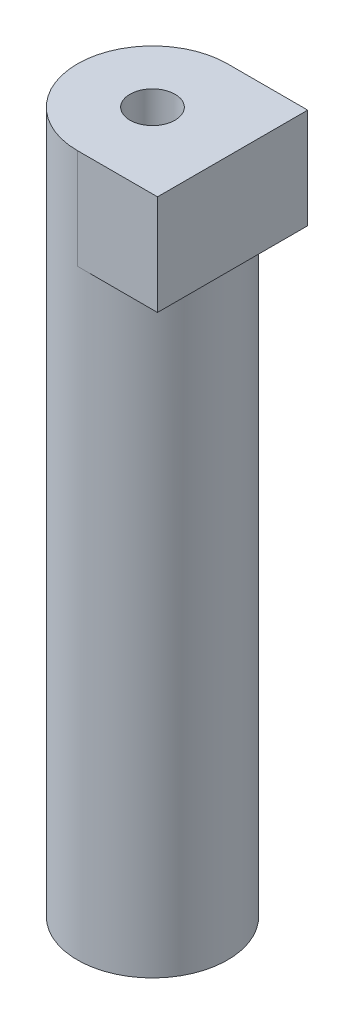
from build123d import *

# Parameters (mm, degrees)
SKETCH1_R          = 7.5
EXTRUSION1_DEPTH   = 160
SKETCH2_R          = 2.25
EXTRUSION2_DEPTH   = 80
EXTRUSION3_START   = -10
EXTRUSION3_DEPTH   = 10
SKETCH4_R          = 9.988310786
EXTRUSION4_DEPTH   = 45
SKETCH5_R          = 7.5
SKETCH5_R_2        = 4
EXTRUSION5_DEPTH   = 15
SKETCH6_R          = 13.00139778
CUT_EXTRUDE1_DEPTH = 45


with BuildPart() as part:
    # Sketch1 → Extrusion1 (new body)
    with BuildSketch(Plane(origin=(0, 0, 0), x_dir=(-1, 0, 0), z_dir=(0, 1, 0))):
        with Locations(Location((0, 0, 0), (0, 0, 90))):
            Circle(SKETCH1_R)
    extrude(amount=EXTRUSION1_DEPTH)

    # Sketch2 → Extrusion2 (cut)
    with BuildSketch(Plane(origin=(0, 160, 0), x_dir=(-1, 0, 0), z_dir=(0, 1, 0))):
        with Locations(Location((0, 0, 0), (0, 0, 90))):
            Circle(SKETCH2_R)
    extrude(amount=-EXTRUSION2_DEPTH, mode=Mode.SUBTRACT)

    # Sketch3 → Extrusion3 (add)
    with BuildSketch(Plane(origin=(0, 160, 0), x_dir=(1, 0, 0), z_dir=(0, 1, 0)).offset(EXTRUSION3_START)):
        with BuildLine():
            Line((0, -7.5), (8, -7.5))
            Line((8, -7.5), (8, 7.5))
            Line((8, 7.5), (0, 7.5))
            ThreePointArc((0, 7.5), (7.5, 0), (0, -7.5))
        make_face()
    extrude(amount=EXTRUSION3_DEPTH)

    # Sketch4 → Extrusion4 (cut)
    with BuildSketch(Plane.XZ):
        Circle(SKETCH4_R)
    extrude(amount=-EXTRUSION4_DEPTH, mode=Mode.SUBTRACT)

    # Sketch5 → Extrusion5 (cut)
    with BuildSketch(Plane.XZ.offset(-45)):
        with Locations(Location((0, 0, 0), (0, 0, 270))):
            Circle(SKETCH5_R)
        with Locations(Location((0, 0, 0), (0, 0, 270))):
            Circle(SKETCH5_R_2, mode=Mode.SUBTRACT)
    extrude(amount=-EXTRUSION5_DEPTH, mode=Mode.SUBTRACT)

    # Sketch6 → Cut-Extrude1 (cut)
    with BuildSketch(Plane.XZ.offset(-45)):
        Circle(SKETCH6_R)
    extrude(amount=-CUT_EXTRUDE1_DEPTH, mode=Mode.SUBTRACT)


solid = part.part
